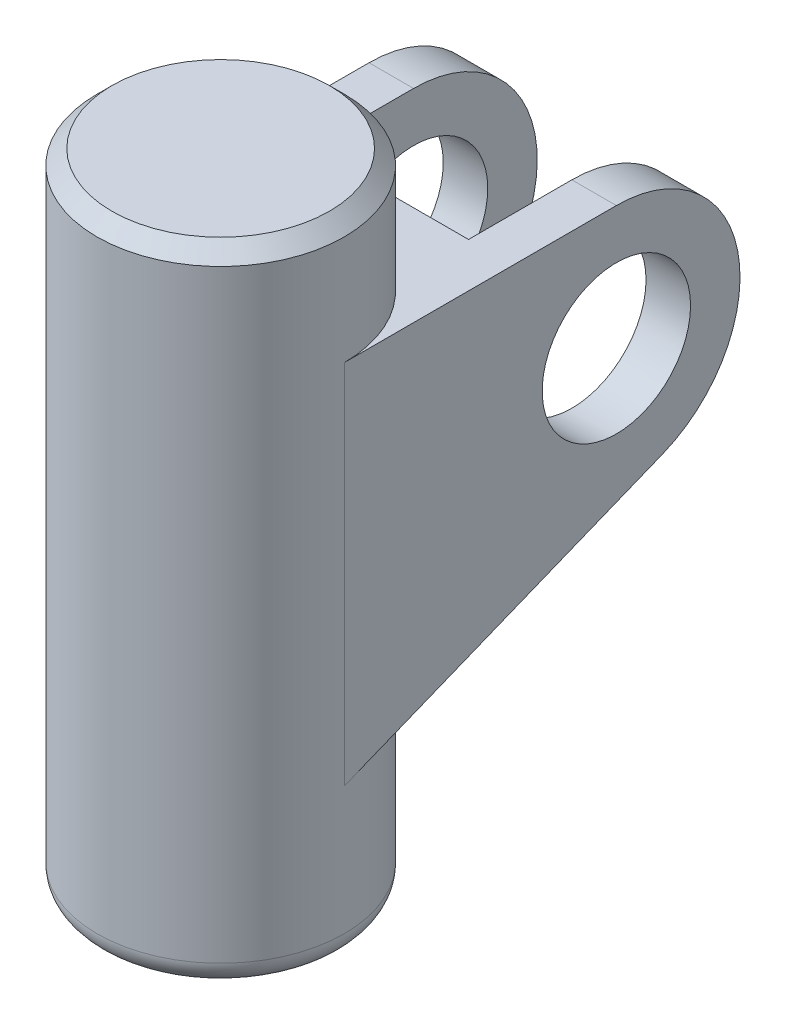
from build123d import *

# Parameters (mm, degrees)
EXTRUDE_8_DEPTH     = 25
EXTRUDE_START       = -25
SKETCH_12_R         = 25
EXTRUDE_9_DEPTH     = 80
FILLET_1_R          = 5
SKETCH_13_R         = 15
CUT_EXTRUDE_1_DEPTH = 80
SKETCH_14_R         = 25
EXTRUDE_10_DEPTH    = 25
CHAMFER_1_SIZE      = 3
SKETCH_15_R         = 15
CUT_EXTRUDE_2_DEPTH = 55
SKETCH_16_W         = 51.322430614
SKETCH_16_H         = 72.336093734
CUT_EXTRUDE_3_DEPTH = 16


with BuildPart() as part:
    # 草图10 → 凸台-拉伸8 (new, symmetric)
    with BuildSketch(Plane(origin=(0, 0, 0), x_dir=(0, 0, -1), z_dir=(1, 0, 0))):
        with BuildLine():
            Line((0, 25), (-55, 25))
            Line((-55, 25), (-55, -49.143520922))
            Line((-55, -49.143520922), (9.352376308, -23.184759162))
            ThreePointArc((9.352376308, -23.184759162), (24.541994408, 4.763455728), (0, 25))
        make_face()
    extrude(amount=EXTRUDE_8_DEPTH, both=True)

    # 草图12 → 凸台-拉伸9 (add)
    with BuildSketch(Plane(origin=(0, 25, 0), x_dir=(1, 0, 0), z_dir=(0, 1, 0)).offset(EXTRUDE_START)):
        with Locations(Location((0, -55, 0), (0, 0, 270))):
            Circle(SKETCH_12_R)
    extrude(amount=-EXTRUDE_9_DEPTH)

    # 圆角1
    fillet_1_edges = [part.edges().sort_by_distance(p)[0] for p in [
        (0, -80, 30),
    ]]
    fillet(fillet_1_edges, radius=FILLET_1_R)

    # 草图13 → 切除-拉伸1 (cut)
    with BuildSketch(Plane.XZ.offset(80)):
        with Locations(Location((0, 55, 0), (0, 0, 270))):
            Circle(SKETCH_13_R)
    extrude(amount=-CUT_EXTRUDE_1_DEPTH, mode=Mode.SUBTRACT)

    # 草图14 → 凸台-拉伸10 (add, symmetric)
    with BuildSketch(Plane(origin=(0, 25, 0), x_dir=(1, 0, 0), z_dir=(0, 1, 0))):
        with Locations(Location((0, -55, 0), (0, 0, 270))):
            Circle(SKETCH_14_R)
    extrude(amount=EXTRUDE_10_DEPTH, both=True)

    # 倒角1
    chamfer_1_edges = [part.edges().sort_by_distance(p)[0] for p in [
        (0, 50, 30),
    ]]
    chamfer(chamfer_1_edges, length=CHAMFER_1_SIZE)

    # 草图15 → 切除-拉伸2 (cut)
    with BuildSketch(Plane(origin=(25, 0, 0), x_dir=(0, 0, -1), z_dir=(1, 0, 0))):
        Circle(SKETCH_15_R)
    extrude(amount=-CUT_EXTRUDE_2_DEPTH, mode=Mode.SUBTRACT)

    # 草图16 → 切除-拉伸3 (cut, symmetric)
    with BuildSketch(Plane(origin=(0, 0, 0), x_dir=(0, 0, -1), z_dir=(1, 0, 0))):
        with Locations((4.773637783, -2.635053382)):
            Rectangle(SKETCH_16_W, SKETCH_16_H)
    extrude(amount=CUT_EXTRUDE_3_DEPTH, both=True, mode=Mode.SUBTRACT)


solid = part.part
